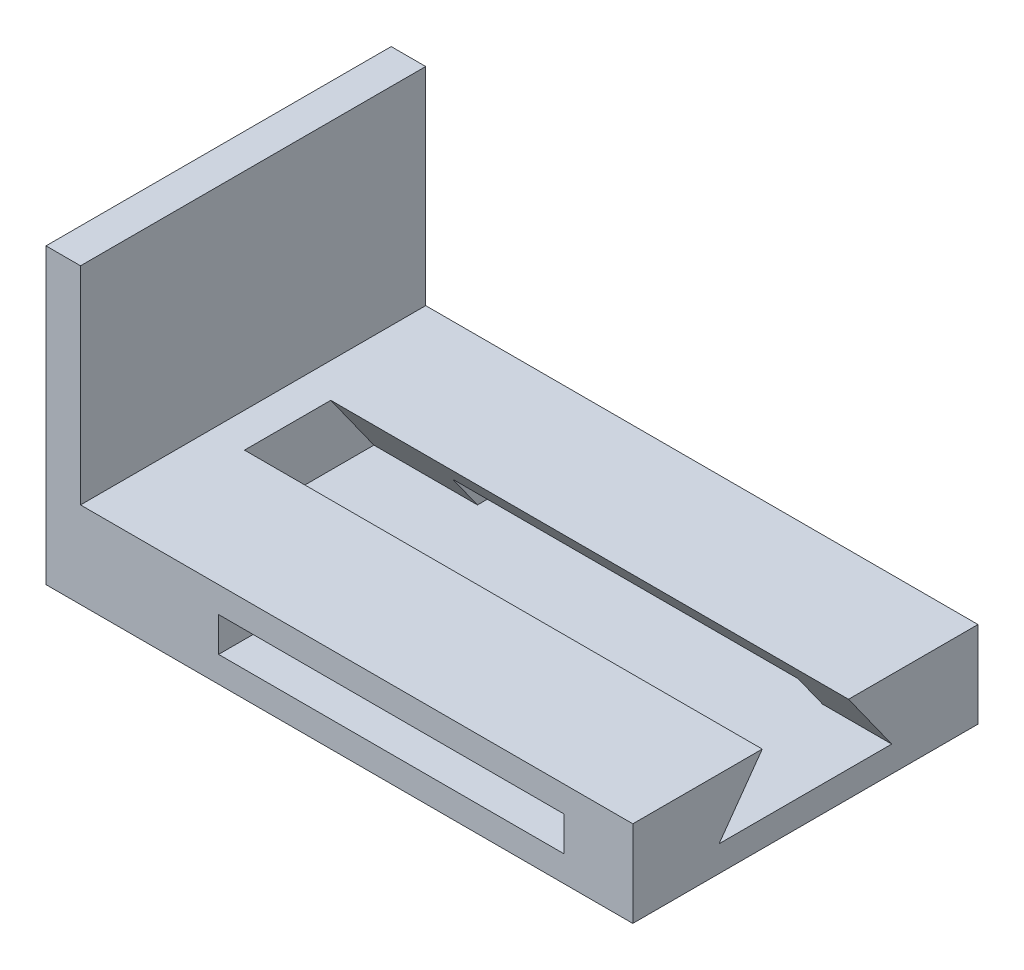
from build123d import *

# Parameters (mm, degrees)
SKETCH3_W                = 20
SKETCH3_H                = 12
BOSS_EXTRUDE3_DEPTH      = 2
BOSS_EXTRUDE5_DEPTH      = 32
BOSS_EXTRUDE5_DEPTH_BACK = 2
SKETCH4_W                = 20
SKETCH4_H                = 5
CUT_EXTRUDE1_DEPTH       = 30
SKETCH7_W                = 20
SKETCH7_H                = 2
CUT_EXTRUDE2_DEPTH       = 43.95346319


with BuildPart() as part:
    # Sketch3 → Boss-Extrude3 (new body)
    with BuildSketch(Plane(origin=(0, 0, 0), x_dir=(0, 0, -1), z_dir=(1, 0, 0))):
        with Locations((10, -6)):
            Rectangle(SKETCH3_W, SKETCH3_H)
    extrude(amount=BOSS_EXTRUDE3_DEPTH)

    # Sketch4 → Boss-Extrude5 (add, two sides: drawn at the far end of the back side and taken through both)
    with BuildSketch(Plane(origin=(2, 0, 0), x_dir=(0, 0, -1), z_dir=(1, 0, 0)).offset(-BOSS_EXTRUDE5_DEPTH_BACK)):
        with Locations((10, -14.5)):
            Rectangle(SKETCH4_W, SKETCH4_H)
    extrude(amount=BOSS_EXTRUDE5_DEPTH + BOSS_EXTRUDE5_DEPTH_BACK)

    # Sketch6 → Cut-Extrude1 (cut)
    with BuildSketch(Plane(origin=(34, 0, 0), x_dir=(0, 0, -1), z_dir=(1, 0, 0))):
        Polygon((5, -15.5), (15, -15.5), (12.5, -12), (7.5, -12), align=None)
    extrude(amount=-CUT_EXTRUDE1_DEPTH, mode=Mode.SUBTRACT)

    # Sketch7 → Cut-Extrude2 (cut, through all)
    with BuildSketch(Plane(origin=(0, 0, -20), x_dir=(-1, 0, 0), z_dir=(0, 0, -1))):
        with Locations((-20, -14.5)):
            Rectangle(SKETCH7_W, SKETCH7_H)
    extrude(amount=-CUT_EXTRUDE2_DEPTH, mode=Mode.SUBTRACT)


solid = part.part
